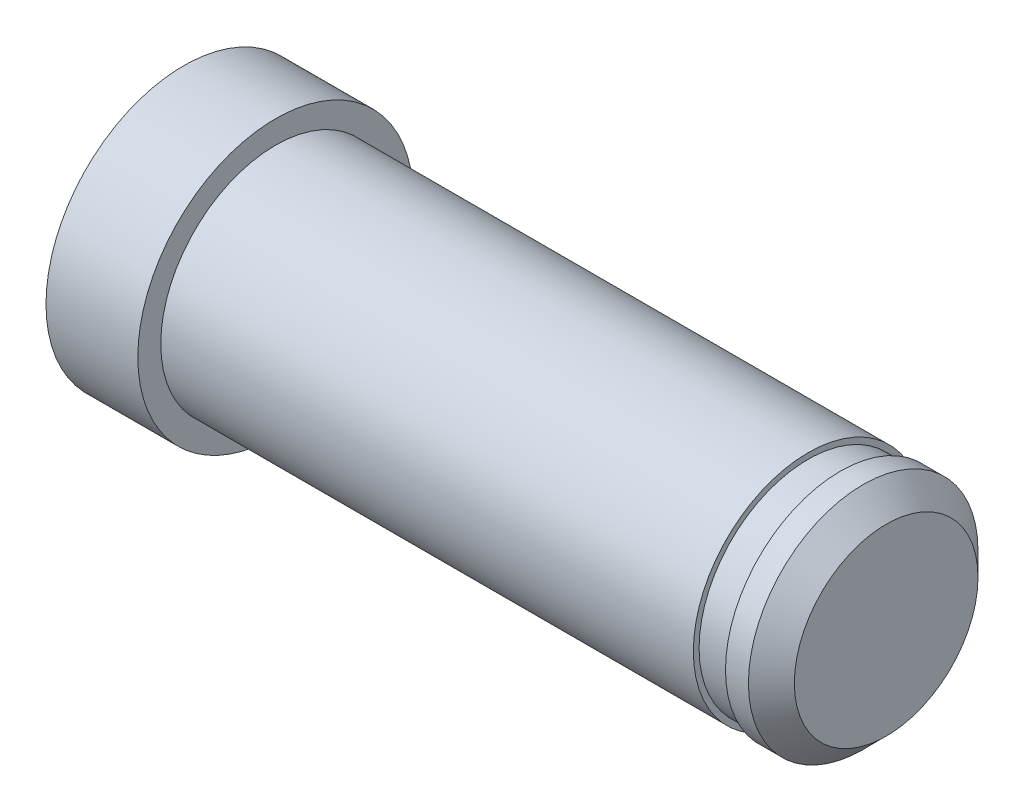
from build123d import *

# Parameters (mm, degrees)
CHAMFER_1_SIZE = 0.5


with BuildPart() as part:
    # 草图1 → 旋转1 (revolve)
    with BuildSketch(Plane.XY, mode=Mode.PRIVATE) as revolve_1_sk:
        Polygon((-15.3, 0), (0, 0), (0, 2.5), (-1, 2.5), (-1, 2.375), (-1.7, 2.375), (-1.7, 2.5), (-13.3, 2.5), (-13.3, 3), (-15.3, 3), align=None)
    revolve(revolve_1_sk.sketch.rotate(Axis((-15.3, 0, 0), (1, 0, 0)), 90), axis=Axis((-15.3, 0, 0), (1, 0, 0)))

    # 倒角1
    chamfer_1_edges = [part.edges().sort_by_distance(p)[0] for p in [
        (0, 0, -2.5),
    ]]
    chamfer(chamfer_1_edges, length=CHAMFER_1_SIZE)


solid = part.part
